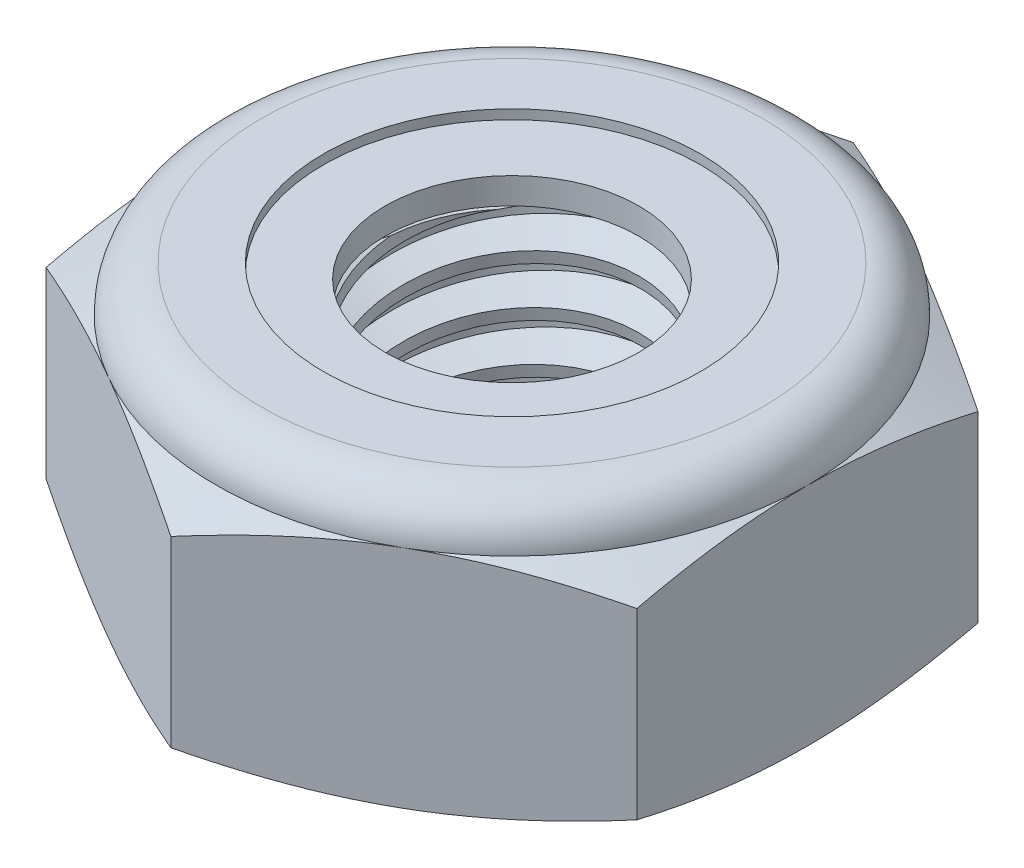
from build123d import *

# Parameters (mm, degrees)
EXTRUDE1_DEPTH      = 4.365625
SKETCH2_W           = 2.413
SKETCH2_H           = 4.365625
LPATTERN1_COUNT     = 6
LPATTERN1_PITCH     = 0.79375
LPATTERN1_COL_COUNT = 2
LPATTERN1_COL_PITCH = 0.79375


with BuildPart() as part:
    # Sketch1 → Extrude1 (new body)
    with BuildSketch(Plane(origin=(0, 0, 0), x_dir=(1, 0, 0), z_dir=(0, 1, 0))):
        Polygon((0, 5.499261314), (-4.7625, 2.749630657), (-4.7625, -2.749630657), (0, -5.499261314), (4.7625, -2.749630657), (4.7625, 2.749630657), align=None)
    extrude(amount=EXTRUDE1_DEPTH)

    # Sketch4 → Cut-Revolve2 (revolve, cut)
    with BuildSketch(Plane(origin=(0, 0, 0), x_dir=(0, 0, -1), z_dir=(1, 0, 0))):
        Polygon((0, 4.365625), (2.413, 4.365625), (2.045424837, 4.194221887), (2.045424837, 0.171403113), (2.413, 0), (0, 0), align=None)
    revolve(axis=Axis((0, 4.365625, 0), (0, 1, 0)), mode=Mode.SUBTRACT)


with BuildPart() as body_2:
    # Sketch2 → Revolve1 (revolve)
    with BuildSketch(Plane(origin=(0, 0, 0), x_dir=(0, 0, -1), z_dir=(1, 0, 0))):
        with Locations((1.2065, 2.1828125)):
            Rectangle(SKETCH2_W, SKETCH2_H)
    revolve(axis=Axis((0, -2.413, 0), (0, 1, 0)))

    # Sketch3 → Cut-Revolve1 (revolve, cut)
    with BuildSketch(Plane(origin=(0, 0, 0), x_dir=(0, 0, -1), z_dir=(1, 0, 0)), mode=Mode.PRIVATE) as cut_revolve1_sk:
        Polygon((2.429102527, 4.267721635), (2.541820218, 3.582398076), (2.077629892, 3.757430502), (2.045424837, 3.953237233), align=None)
    cut_revolve1 = revolve(cut_revolve1_sk.sketch.rotate(Axis((0, 4.365625, 0.139697061), (0, -0.9867425810390564, -0.1622931876708976)), 180), axis=Axis((0, 4.365625, 0.139697061), (0, -0.9867425810390564, -0.1622931876708976)), mode=Mode.SUBTRACT)

    # LPattern1: Cut-Revolve1 ×6
    with Locations(*[(0, -i * LPATTERN1_PITCH, 0) for i in range(1, LPATTERN1_COUNT)]):
        add(cut_revolve1, mode=Mode.SUBTRACT)

    # LPattern1 col: Cut-Revolve1 ×2
    with Locations(*[(0, i * LPATTERN1_COL_PITCH, 0) for i in range(1, LPATTERN1_COL_COUNT)]):
        add(cut_revolve1, mode=Mode.SUBTRACT)


with BuildPart() as part_1:
    add(part.part)

    # Combine1: cut body 2
    add(body_2.part, mode=Mode.SUBTRACT)

    # Sketch5 → Cut-Revolve3 (revolve, cut)
    with BuildSketch(Plane(origin=(0, 0, 0), x_dir=(0, 0, -1), z_dir=(1, 0, 0)), mode=Mode.PRIVATE) as cut_revolve3_sk:
        with BuildLine():
            Line((0, 0), (4.7625, 0))
            Line((4.7625, 0), (5.499261314, 0.343557443))
            Line((5.499261314, 0.343557443), (5.499261314, 3.29446339))
            Line((5.499261314, 3.29446339), (4.7625, 3.638020833))
            ThreePointArc((4.7625, 3.638020833), (4.549389674, 4.152514674), (4.034895833, 4.365625))
            Line((4.034895833, 4.365625), (4.034895833, 5.635625))
            Line((4.034895833, 5.635625), (6.769261314, 5.635625))
            Line((6.769261314, 5.635625), (6.769261314, -1.27))
            Line((6.769261314, -1.27), (0, -1.27))
            Line((0, -1.27), (0, 0))
        make_face()
    revolve(cut_revolve3_sk.sketch.rotate(Axis((0, 0, 0), (0, 1, 0)), 55.135741266), axis=Axis((0, 0, 0), (0, 1, 0)), mode=Mode.SUBTRACT)

    # Sketch6 → Cut-Revolve4 (revolve, cut)
    with BuildSketch(Plane(origin=(0, 0, 0), x_dir=(0, 0, -1), z_dir=(1, 0, 0)), mode=Mode.PRIVATE) as cut_revolve4_sk:
        with BuildLine():
            Line((0, 3.638020833), (4.6101, 3.638020833))
            ThreePointArc((4.6101, 3.638020833), (4.4416266, 4.0447516), (4.034895833, 4.213225))
            Line((4.034895833, 4.213225), (3.040160335, 4.213225))
            Line((3.040160335, 4.213225), (3.040160335, 5.635625))
            Line((3.040160335, 5.635625), (0, 5.635625))
            Line((0, 5.635625), (0, 3.638020833))
        make_face()
    revolve(cut_revolve4_sk.sketch.rotate(Axis((0, 5.635625, 0), (0, 1, 0)), 55.135741266), axis=Axis((0, 5.635625, 0), (0, 1, 0)), mode=Mode.SUBTRACT)


with BuildPart() as body_2_2:
    # Sketch7 → Revolve2 (revolve)
    with BuildSketch(Plane(origin=(0, 0, 0), x_dir=(0, 0, -1), z_dir=(1, 0, 0))):
        with BuildLine():
            Line((2.045424837, 3.714220833), (4.528047654, 3.714220833))
            ThreePointArc((4.528047654, 3.714220833), (4.359688876, 4.016854092), (4.034895833, 4.137025))
            Line((4.034895833, 4.137025), (2.045424837, 4.137025))
            Line((2.045424837, 4.137025), (2.045424837, 3.714220833))
        make_face()
    revolve(axis=Axis((0, 3.714220833, 0), (0, 1, 0)))


solid = Compound([part_1.part, body_2_2.part])
